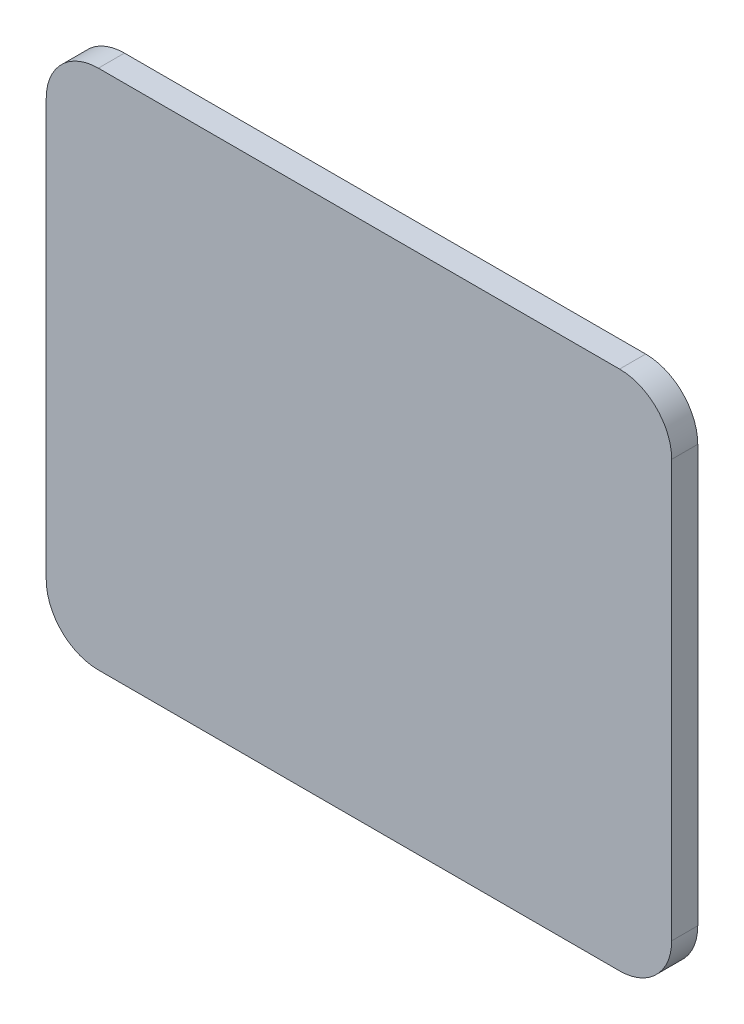
from build123d import *

# Parameters (mm, degrees)
SZKIC1_W                    = 120
SZKIC1_H                    = 100
DODANIE_WYCI_GNI_CIE1_DEPTH = 5
ZAOKR_GLENIE1_R             = 10


with BuildPart() as part:
    # Szkic1 → Dodanie-wyciągnięcie1 (new body)
    with BuildSketch(Plane.XY):
        Rectangle(SZKIC1_W, SZKIC1_H)
    extrude(amount=DODANIE_WYCI_GNI_CIE1_DEPTH)

    # Zaokrąglenie1
    zaokr_glenie1_edges = [part.edges().sort_by_distance(p)[0] for p in [
        (-60, -50, 2.5),
        (60, -50, 2.5),
        (60, 50, 2.5),
        (-60, 50, 2.5),
    ]]
    fillet(zaokr_glenie1_edges, radius=ZAOKR_GLENIE1_R)


solid = part.part
